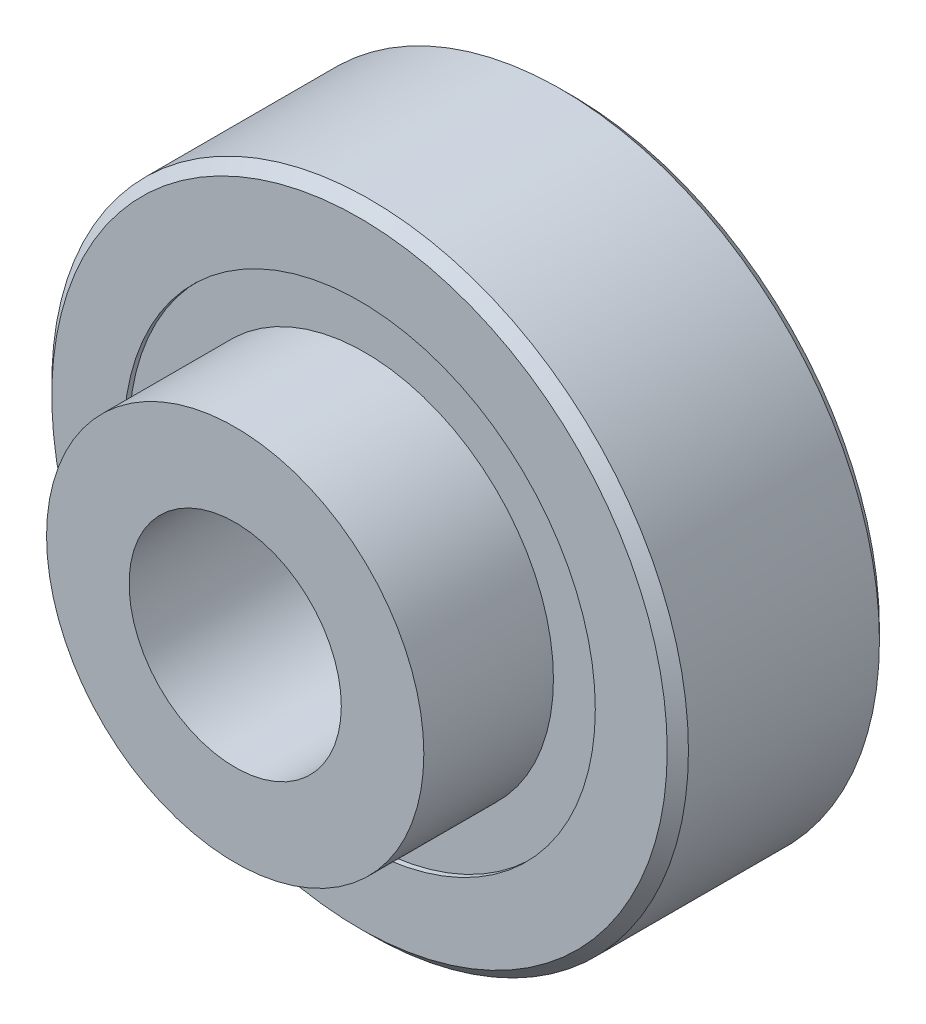
from build123d import *

# Parameters (mm, degrees)
COVER_1_SKETCH_W = 1.585836018
COVER_1_SKETCH_H = 1.555555556
COVER_2_SKETCH_W = 1.585836018
COVER_2_SKETCH_H = 1.555555556


with BuildPart() as part:
    # Outter Chase Sketch → Outter Chase Revolve (revolve)
    with BuildSketch(Plane(origin=(0, 0, 0), x_dir=(0, 0, -1), z_dir=(1, 0, 0)), mode=Mode.PRIVATE) as outter_chase_revolve_sk:
        with BuildLine():
            Line((3.15, 10.5), (-3.15, 10.5))
            Line((-3.15, 10.5), (-3.5, 10.15))
            Line((-3.5, 10.15), (-3.5, 7.777777778))
            Line((-3.5, 7.777777778), (-1.555555556, 7.777777778))
            ThreePointArc((-1.555555556, 7.777777778), (0, 8.739163982), (1.555555556, 7.777777778))
            Line((1.555555556, 7.777777778), (3.5, 7.777777778))
            Line((3.5, 7.777777778), (3.5, 10.15))
            Line((3.5, 10.15), (3.15, 10.5))
        make_face()
    revolve(outter_chase_revolve_sk.sketch.rotate(Axis((0, 0, 3.5), (0, 0, -1)), 90), axis=Axis((0, 0, 3.5), (0, 0, -1)))


with BuildPart() as body_2:
    # Inner Chase Sketch → Inner Chase Revolve (revolve)
    with BuildSketch(Plane(origin=(0, 0, 0), x_dir=(0, 0, -1), z_dir=(1, 0, 0)), mode=Mode.PRIVATE) as inner_chase_revolve_sk:
        with BuildLine():
            Line((-3.5, 6.222222222), (-1.555555556, 6.222222222))
            ThreePointArc((-1.555555556, 6.222222222), (0, 5.260836018), (1.555555556, 6.222222222))
            Line((1.555555556, 6.222222222), (3.5, 6.222222222))
            Line((3.5, 6.222222222), (3.5, 3.85))
            Line((3.5, 3.85), (3.15, 3.5))
            Line((3.15, 3.5), (-3.15, 3.5))
            Line((-3.15, 3.5), (-3.5, 3.85))
            Line((-3.5, 3.85), (-3.5, 6.222222222))
        make_face()
    revolve(inner_chase_revolve_sk.sketch.rotate(Axis((0, 0, 3.5), (0, 0, -1)), 90), axis=Axis((0, 0, 3.5), (0, 0, -1)))

    # Flange Sketch → Flange Revolve (revolve)
    with BuildSketch(Plane(origin=(0, 0, 0), x_dir=(0, 0, -1), z_dir=(1, 0, 0)), mode=Mode.PRIVATE) as flange_revolve_sk:
        Polygon((-3.15, 3.5), (-3.5, 3.85), (-3.5, 6.222222222), (-7.6, 6.222222222), (-7.6, 3.5), align=None)
    revolve(flange_revolve_sk.sketch.rotate(Axis((0, 0, 3.5), (0, 0, -1)), 90), axis=Axis((0, 0, 3.5), (0, 0, -1)))


with BuildPart() as body_3:
    # Cover 1 Sketch → Cover 1 Revolve (revolve)
    with BuildSketch(Plane(origin=(0, 0, 0), x_dir=(0, 0, -1), z_dir=(1, 0, 0)), mode=Mode.PRIVATE) as cover_1_revolve_sk:
        with Locations((-2.532081991, 7)):
            Rectangle(COVER_1_SKETCH_W, COVER_1_SKETCH_H)
    revolve(cover_1_revolve_sk.sketch.rotate(Axis((0, 0, 3.5), (0, 0, -1)), 90), axis=Axis((0, 0, 3.5), (0, 0, -1)))


with BuildPart() as body_4:
    # Cover 2 Sketch → Cover 2 Revolve (revolve)
    with BuildSketch(Plane(origin=(0, 0, 0), x_dir=(0, 0, -1), z_dir=(1, 0, 0)), mode=Mode.PRIVATE) as cover_2_revolve_sk:
        with Locations((2.532081991, 7)):
            Rectangle(COVER_2_SKETCH_W, COVER_2_SKETCH_H)
    revolve(cover_2_revolve_sk.sketch.rotate(Axis((0, 0, 3.5), (0, 0, -1)), 90), axis=Axis((0, 0, 3.5), (0, 0, -1)))


solid = Compound([part.part, body_2.part, body_3.part, body_4.part])
